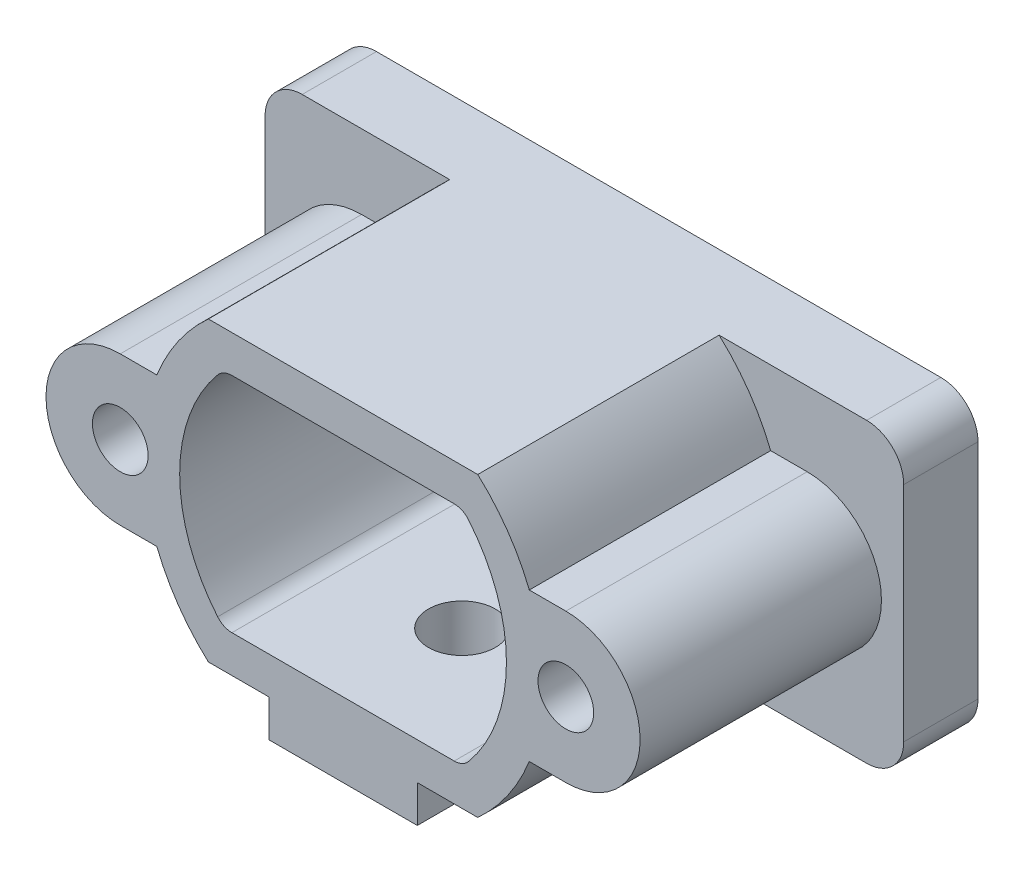
from build123d import *

# Parameters (mm, degrees)
EXTRUDE_1_DEPTH     = 20
EXTRUDE_2_DEPTH     = 65
SKETCH_4_R          = 7.5
CUT_EXTRUDE_1_DEPTH = 85
CUT_EXTRUDE_2_DEPTH = 20
EXTRUDE_3_DEPTH     = 10
SKETCH_7_R          = 9
CUT_EXTRUDE_3_DEPTH = 20
FILLET_1_R          = 5


with BuildPart() as part:
    # 草图1 → 凸台-拉伸1 (new body)
    with BuildSketch(Plane.XY):
        with BuildLine():
            Line((76, -40), (-76, -40))
            ThreePointArc((-76, -40), (-83.071067812, -37.071067812), (-86, -30))
            Line((-86, -30), (-86, 30))
            ThreePointArc((-86, 30), (-83.071067812, 37.071067812), (-76, 40))
            Line((-76, 40), (76, 40))
            ThreePointArc((76, 40), (83.071067812, 37.071067812), (86, 30))
            Line((86, 30), (86, -30))
            ThreePointArc((86, -30), (83.071067812, -37.071067812), (76, -40))
        make_face()
    extrude(amount=EXTRUDE_1_DEPTH)

    # 草图3 → 凸台-拉伸2 (add)
    with BuildSketch(Plane.XY.offset(20)):
        with BuildLine():
            Line((-36.276714294, 40), (36.276714294, 40))
            ThreePointArc((36.276714294, 40), (44.36006499, 30.792606809), (50.159744816, 20))
            Line((50.159744816, 20), (60, 20))
            ThreePointArc((60, 20), (80, 0), (60, -20))
            Line((60, -20), (50.159744816, -20))
            ThreePointArc((50.159744816, -20), (44.36006499, -30.792606809), (36.276714294, -40))
            Line((36.276714294, -40), (-36.276714294, -40))
            ThreePointArc((-36.276714294, -40), (-44.36006499, -30.792606809), (-50.159744816, -20))
            Line((-50.159744816, -20), (-60, -20))
            ThreePointArc((-60, -20), (-80, 0), (-60, 20))
            Line((-60, 20), (-50.159744816, 20))
            ThreePointArc((-50.159744816, 20), (-44.36006499, 30.792606809), (-36.276714294, 40))
        make_face()
        with BuildLine():
            Line((32.186953879, -30), (-32.186953879, -30))
            ThreePointArc((-32.186953879, -30), (-44, 0), (-32.186953879, 30))
            Line((-32.186953879, 30), (32.186953879, 30))
            ThreePointArc((32.186953879, 30), (44, 0), (32.186953879, -30))
        make_face(mode=Mode.SUBTRACT)
    extrude(amount=EXTRUDE_2_DEPTH)

    # 草图4 → 切除-拉伸1 (cut)
    with BuildSketch(Plane.XY.offset(85)):
        with Locations((-60, 0)):
            Circle(SKETCH_4_R)
        with Locations((60, 0)):
            Circle(SKETCH_4_R)
    extrude(amount=-CUT_EXTRUDE_1_DEPTH, mode=Mode.SUBTRACT)

    # 草图5 → 切除-拉伸2 (cut)
    with BuildSketch(Plane.XY.offset(20)):
        with BuildLine():
            Line((-18.708286934, -12.5), (-30, -12.5))
            Line((-30, -12.5), (-30, 12.5))
            Line((-30, 12.5), (-18.708286934, 12.5))
            ThreePointArc((-18.708286934, 12.5), (0, 22.5), (18.708286934, 12.5))
            Line((18.708286934, 12.5), (30, 12.5))
            Line((30, 12.5), (30, -12.5))
            Line((30, -12.5), (18.708286934, -12.5))
            ThreePointArc((18.708286934, -12.5), (0, -22.5), (-18.708286934, -12.5))
        make_face()
    extrude(amount=-CUT_EXTRUDE_2_DEPTH, mode=Mode.SUBTRACT)

    # 草图6 → 凸台-拉伸3 (add)
    with BuildSketch(Plane.XZ.offset(40)):
        with BuildLine():
            Line((20, 53), (20, 85))
            Line((20, 85), (-20, 85))
            Line((-20, 85), (-20, 53))
            ThreePointArc((-20, 53), (0, 33), (20, 53))
        make_face()
    extrude(amount=EXTRUDE_3_DEPTH)

    # 草图7 → 切除-拉伸3 (cut)
    with BuildSketch(Plane.XZ.offset(50)):
        with Locations((0, 53)):
            Circle(SKETCH_7_R)
    extrude(amount=-CUT_EXTRUDE_3_DEPTH, mode=Mode.SUBTRACT)

    # 圆角1
    fillet_1_edges = [part.edges().sort_by_distance(p)[0] for p in [
        (32.186953879, 30, 52.5),
        (-32.186953879, 30, 52.5),
        (-32.186953879, -30, 52.5),
        (32.186953879, -30, 52.5),
    ]]
    fillet(fillet_1_edges, radius=FILLET_1_R)


solid = part.part
